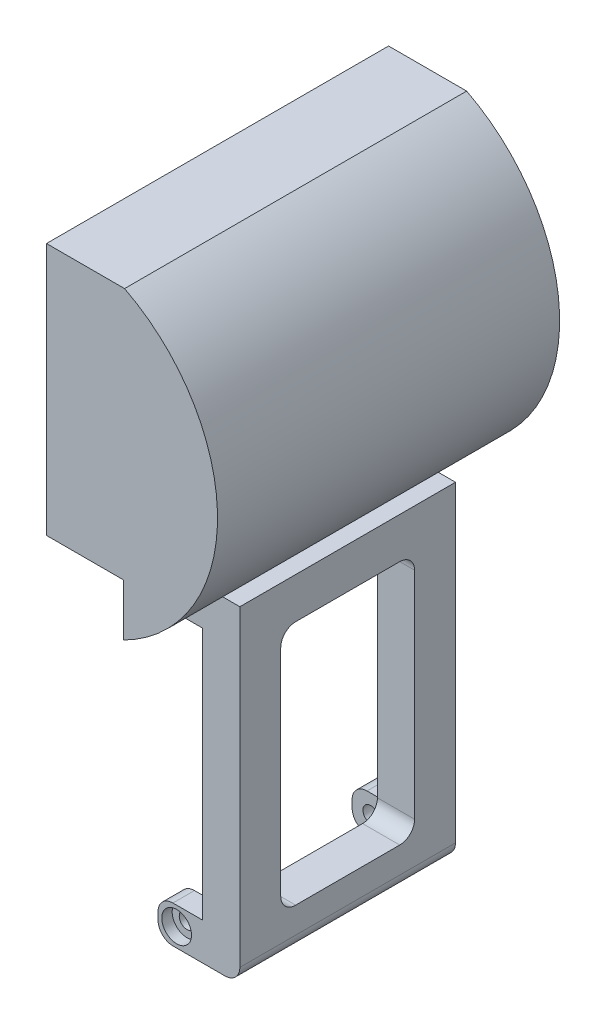
from build123d import *
from build123d.topology import SkipClean

# Parameters (mm, degrees)
BOSS_EXTRUDE1_DEPTH = 23
BOSS_EXTRUDE2_DEPTH = 2
SKETCH3_R           = 1.05
BOSS_EXTRUDE3_DEPTH = 14.5
CUT_EXTRUDE1_REACH  = 90.03
SKETCH4_W           = 17
SKETCH4_H           = 23.2
CUT_EXTRUDE2_DEPTH  = 7
SKETCH6_R           = 1.05
CUT_EXTRUDE3_DEPTH  = 61.135264197
SKETCH7_W           = 18
SKETCH7_H           = 33
CUT_EXTRUDE4_DEPTH  = 51.162236792
FILLET1_R           = 2
SKETCH8_R           = 2
CUT_EXTRUDE5_DEPTH  = 1.4


with BuildPart() as part:
    # Sketch1 → Boss-Extrude1 (new, symmetric)
    with BuildSketch(Plane.XY):
        with BuildLine():
            Line((0, 41), (3.464101615, 39))
            Line((3.464101615, 39), (7.687881875, 39))
            ThreePointArc((7.687881875, 39), (19.943980289, 22.03249582), (10.356028111, 3.42660107))
            Line((10.356028111, 3.42660107), (0, 3.42660107))
            Line((0, 3.42660107), (0, 0))
            Line((0, 0), (10.356028111, 0))
            ThreePointArc((10.356028111, 0), (22.999858198, 20.45585385), (10.5, 41))
            Line((10.5, 41), (0, 41))
        make_face()
    extrude(amount=BOSS_EXTRUDE1_DEPTH, both=True)

    # Sketch2 → Boss-Extrude2 (add)
    with BuildSketch(Plane.XY.offset(23)):
        with BuildLine():
            Line((0, 41), (0, 3.42660107))
            Line((0, 3.42660107), (10.356028111, 3.42660107))
            ThreePointArc((10.356028111, 3.42660107), (19.943980289, 22.03249582), (7.687881875, 39))
            Line((7.687881875, 39), (3.464101615, 39))
            Line((3.464101615, 39), (0, 41))
        make_face()
    boss_extrude2 = extrude(amount=-BOSS_EXTRUDE2_DEPTH)

    # Sketch3 → Boss-Extrude3 (add, symmetric)
    with BuildSketch(Plane.XY):
        Polygon((12.5, -40.8), (6.5, -40.8), (6.5, -35.8), (12.5, -35.8), (12.5, -1.8), (6.5, -1.8), (6.5, 3.2), (12.5, 3.2), (17.5, 3.2), (17.5, -40.8), align=None)
        with Locations((9, 0.7)):
            Circle(SKETCH3_R, mode=Mode.SUBTRACT)
        with Locations(Location((9, -38.3, 0), (0, 0, 180))):
            Circle(SKETCH3_R, mode=Mode.SUBTRACT)
    extrude(amount=BOSS_EXTRUDE3_DEPTH, both=True)

    # Mirror2: Boss-Extrude2 across plane
    add(boss_extrude2.mirror(Plane.XY))

    # Cut-Extrude1: up to this face of the body (flat: up to its plane)
    cut_extrude1_end = Plane(part.part.faces().sort_by_distance((5.178014055, 3.42660107, 0))[0])
    # Sketch4 → Cut-Extrude1 (cut, up to the picked face)
    with BuildSketch(Plane.XZ.offset(40.8), mode=Mode.PRIVATE) as cut_extrude1_sk1:
        with Locations((4, 0)):
            Rectangle(SKETCH4_W, SKETCH4_H)
    cut_extrude1_tool1 = split(extrude(cut_extrude1_sk1.sketch, amount=-CUT_EXTRUDE1_REACH, mode=Mode.PRIVATE), bisect_by=cut_extrude1_end, keep=Keep.BOTH, mode=Mode.PRIVATE)
    add(cut_extrude1_tool1.solids().sort_by(Axis((4, -40.8, 0), (0, 1, 0)))[0], mode=Mode.SUBTRACT)

    # Sketch5 → Cut-Extrude2 (cut)
    with BuildSketch(Plane.XZ):
        Polygon((0, -11.6), (6.5, -11.6), (6.5, -14.5), (10.356028111, -14.5), (10.356028111, -23), (0, -23), align=None)
        Polygon((6.5, 11.6), (0, 11.6), (0, 23), (10.356028111, 23), (10.356028111, 14.5), (6.5, 14.5), align=None)
    extrude(amount=-CUT_EXTRUDE2_DEPTH, mode=Mode.SUBTRACT)

    # Sketch6 → Cut-Extrude3 (cut, through all)
    with SkipClean():  # the faces are left unmerged after this step: merging them gives an invalid solid
        with BuildSketch(Plane.XY.offset(14.5)):
            with Locations(Location((9, 0.7, 0), (0, 0, 180))):
                Circle(SKETCH6_R)
        extrude(amount=-CUT_EXTRUDE3_DEPTH, mode=Mode.SUBTRACT)

    # Sketch7 → Cut-Extrude4 (cut, through all)
    with SkipClean():  # the faces are left unmerged after this step: merging them gives an invalid solid
        with BuildSketch(Plane(origin=(17.5, 0, 0), x_dir=(0, 0, -1), z_dir=(1, 0, 0))):
            with Locations((0, -18.8)):
                Rectangle(SKETCH7_W, SKETCH7_H)
        extrude(amount=-CUT_EXTRUDE4_DEPTH, mode=Mode.SUBTRACT)

    # Fillet1
    fillet1_edges = [part.edges().sort_by_distance(p)[0] for p in [
        (6.5, -40.8, -13.05),
        (6.5, -35.8, -13.05),
        (6.5, -1.8, -13.05),
        (6.5, 3.42660107, -13.05),
        (6.5, 3.42660107, 13.05),
        (15, -35.3, -9),
        (15, -35.3, 9),
        (15, -2.3, 9),
        (15, -2.3, -9),
        (17.5, -40.8, 0),
        (6.5, -1.8, 13.05),
        (6.5, -35.8, 13.05),
        (6.5, -40.8, 13.05),
    ]]
    fillet(fillet1_edges, radius=FILLET1_R)

    # Sketch8 → Cut-Extrude5 (cut)
    with SkipClean():  # the faces are left unmerged after this step: merging them gives an invalid solid
        with BuildSketch(Plane.XY.offset(14.5)):
            with Locations((9, 0.7)):
                Circle(SKETCH8_R)
            with Locations((9, -38.3)):
                Circle(SKETCH8_R)
        cut_extrude5 = extrude(amount=-CUT_EXTRUDE5_DEPTH, mode=Mode.SUBTRACT)

    # Mirror3: Cut-Extrude5 across plane
    with SkipClean():  # the faces are left unmerged after this step: merging them gives an invalid solid
        add(cut_extrude5.mirror(Plane.XY), mode=Mode.SUBTRACT)


solid = part.part
